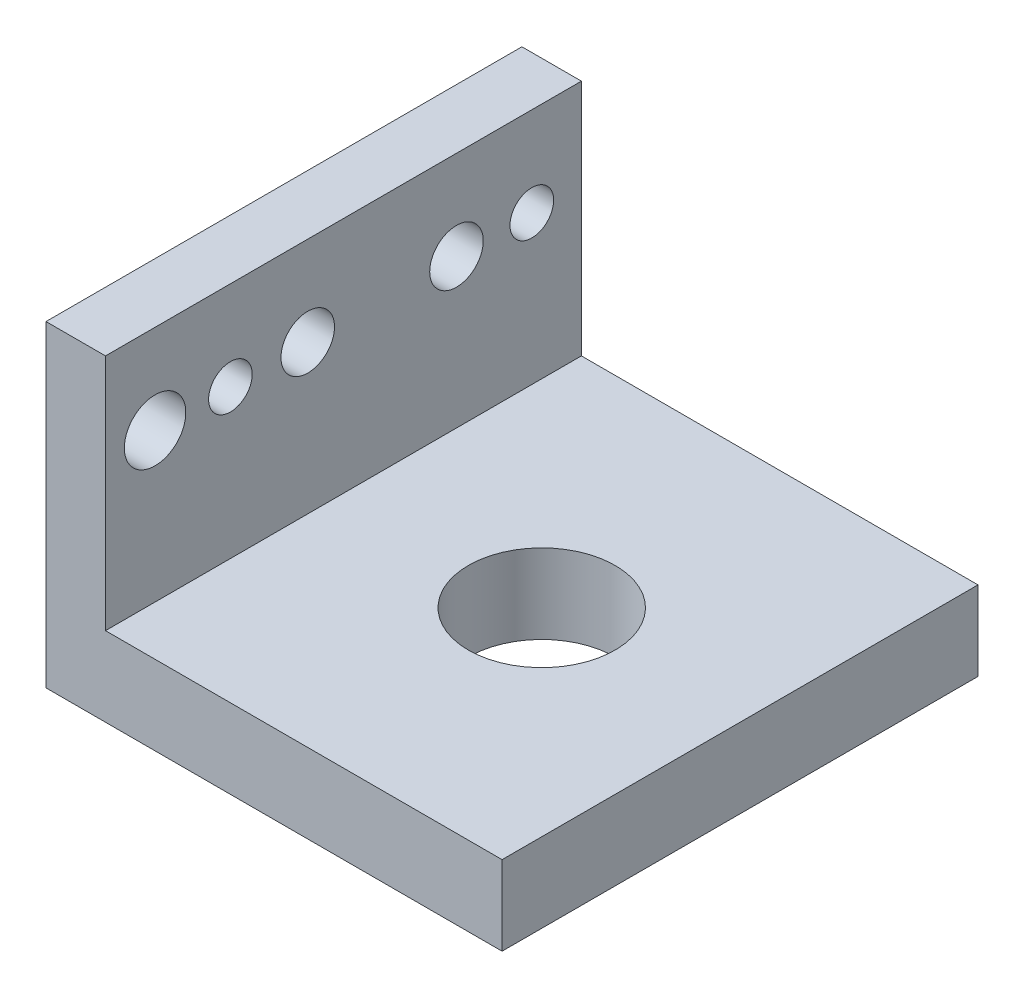
from build123d import *

# Parameters (mm, degrees)
SKETCH_1_W      = 20
SKETCH_1_H      = 24
SKETCH_1_R      = 3.7
EXTRUDE_1_DEPTH = 4
SKETCH_2_W      = 24
SKETCH_2_H      = 16
SKETCH_2_R      = 1.1
SKETCH_2_R_2    = 1.35
SKETCH_2_R_3    = 1.55
EXTRUDE_2_DEPTH = 3


with BuildPart() as part:
    # 草图1 → 凸台-拉伸1 (new body)
    with BuildSketch(Plane(origin=(0, 0, 0), x_dir=(1, 0, 0), z_dir=(0, 1, 0))):
        with Locations((10, 12)):
            Rectangle(SKETCH_1_W, SKETCH_1_H)
        with Locations(Location((10, 12, 0), (0, 0, 270))):
            Circle(SKETCH_1_R, mode=Mode.SUBTRACT)
    extrude(amount=EXTRUDE_1_DEPTH)

    # 草图2 → 凸台-拉伸2 (add)
    with BuildSketch(Plane.ZY):
        with Locations((-12, 8)):
            Rectangle(SKETCH_2_W, SKETCH_2_H)
        with Locations((-21.5, 11.5)):
            Circle(SKETCH_2_R, mode=Mode.SUBTRACT)
        with Locations((-17.7, 11.5)):
            Circle(SKETCH_2_R_2, mode=Mode.SUBTRACT)
        with Locations((-6.3, 11.5)):
            Circle(SKETCH_2_R, mode=Mode.SUBTRACT)
        with Locations((-2.5, 11.5)):
            Circle(SKETCH_2_R_3, mode=Mode.SUBTRACT)
        with Locations((-10.2, 11.5)):
            Circle(SKETCH_2_R_2, mode=Mode.SUBTRACT)
    extrude(amount=EXTRUDE_2_DEPTH)


solid = part.part
